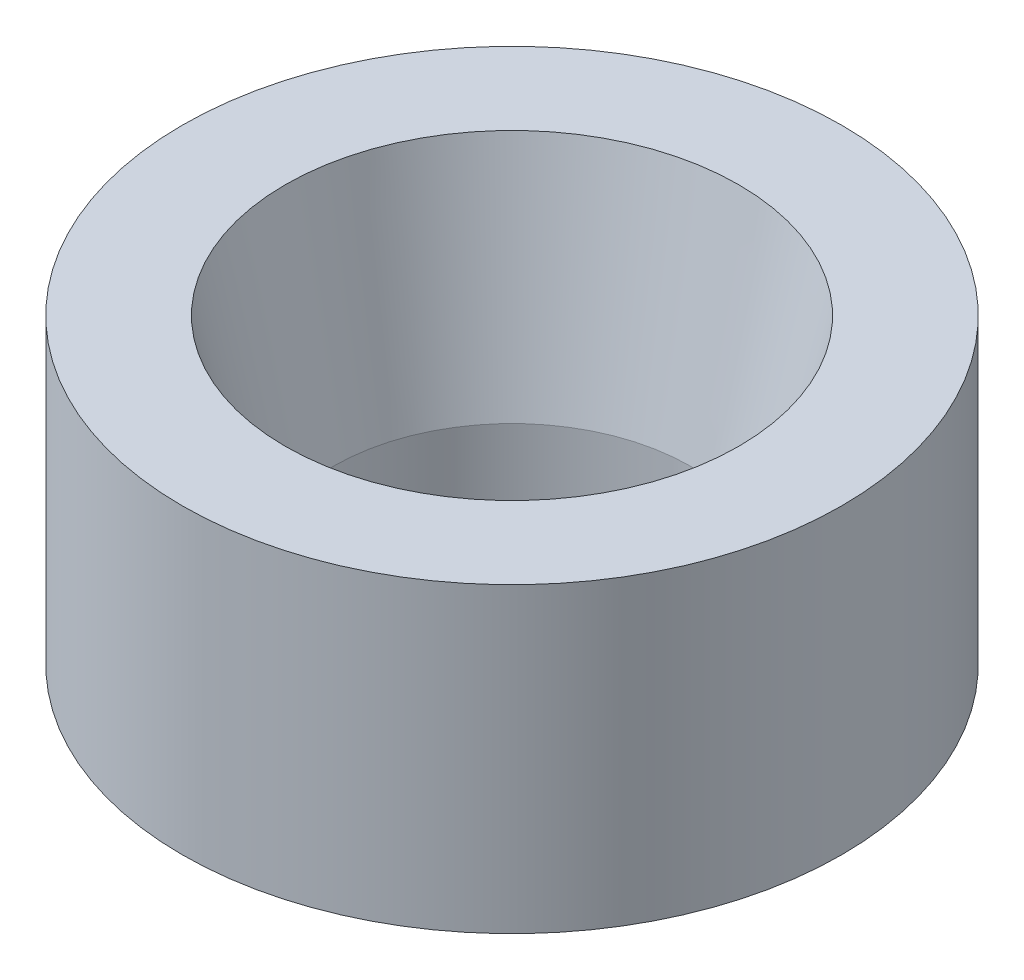
from build123d import *


with BuildPart() as part:
    # Sketch1 → Revolve1 (revolve)
    with BuildSketch(Plane.XY, mode=Mode.PRIVATE) as revolve1_sk:
        Polygon((13, 0), (13, 6), (16.5, 22), (24, 22), (24, 0), align=None)
    revolve(revolve1_sk.sketch.rotate(Axis((0, 34.553672316, 0), (0, -1, 0)), 90), axis=Axis((0, 34.553672316, 0), (0, -1, 0)))


solid = part.part
